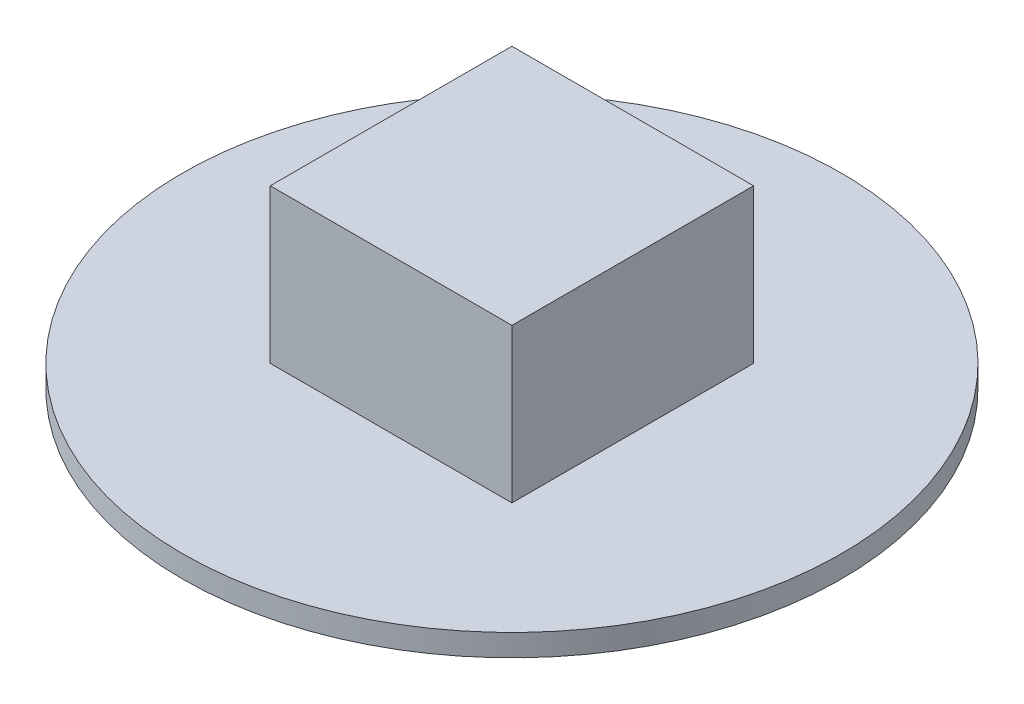
from build123d import *

# Parameters (mm, degrees)
SKETCH_1_R      = 150
EXTRUDE_2_DEPTH = 10
SKETCH_2_W      = 110
SKETCH_2_H      = 110
EXTRUDE_3_DEPTH = 70


with BuildPart() as part:
    # 草图1 → 凸台-拉伸2 (new body)
    with BuildSketch(Plane(origin=(0, 0, 0), x_dir=(1, 0, 0), z_dir=(0, 1, 0))):
        with Locations(Location((0, 0, 0), (0, 0, 270))):
            Circle(SKETCH_1_R)
    extrude(amount=EXTRUDE_2_DEPTH)

    # 草图2 → 凸台-拉伸3 (add)
    with BuildSketch(Plane(origin=(0, 10, 0), x_dir=(1, 0, 0), z_dir=(0, 1, 0))):
        Rectangle(SKETCH_2_W, SKETCH_2_H)
    extrude(amount=EXTRUDE_3_DEPTH)


solid = part.part
